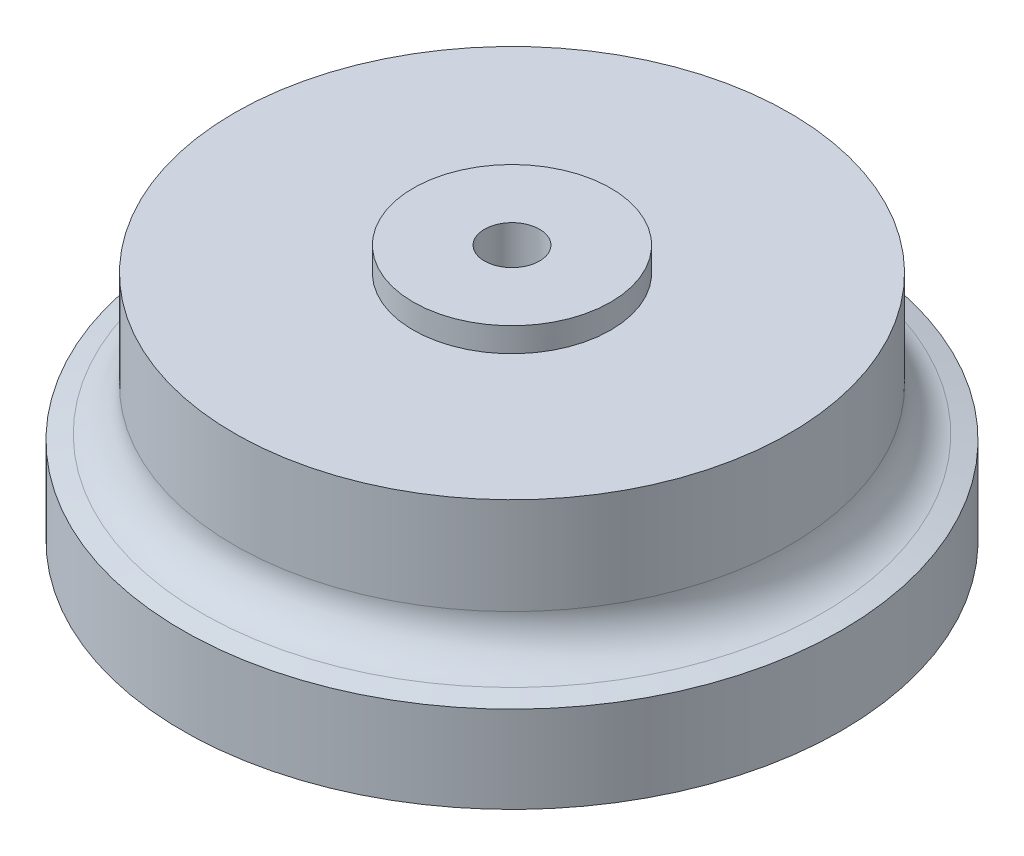
from build123d import *

# Parameters (mm, degrees)
F_1_4_0_25_DIAMETER_HOLE1_D = 6.35
SKETCH3_R                   = 11.3792
SKETCH3_R_2                 = 3.175
BOSS_EXTRUDE1_DEPTH         = 2.794


with BuildPart() as part:
    # Sketch1 → Revolve1 (revolve)
    with BuildSketch(Plane.XY, mode=Mode.PRIVATE) as revolve1_sk:
        with BuildLine():
            Line((0, 0), (37.973, 0))
            Line((37.973, 0), (37.973, 10.0076))
            Line((37.973, 10.0076), (35.750149251, 10.603211063))
            ThreePointArc((35.750149251, 10.603211063), (33.034715031, 12.417606201), (31.98495, 15.510114261))
            Line((31.98495, 15.510114261), (31.98495, 26.67))
            Line((31.98495, 26.67), (0, 26.67))
            Line((0, 26.67), (0, 0))
        make_face()
    revolve(revolve1_sk.sketch.rotate(Axis((0, 26.67, 0), (0, -1, 0)), 180), axis=Axis((0, 26.67, 0), (0, -1, 0)))

    # 1/4 (0.25) Diameter Hole1 (through all)
    with Locations(Plane(origin=(0, 26.67, 0), x_dir=(1, 0, 0), z_dir=(0, 1, 0))):
        with Locations((0, 0)):
            Hole(F_1_4_0_25_DIAMETER_HOLE1_D / 2)

    # Sketch3 → Boss-Extrude1 (add)
    with BuildSketch(Plane(origin=(0, 26.67, 0), x_dir=(1, 0, 0), z_dir=(0, 1, 0))):
        Circle(SKETCH3_R)
        with Locations(Location((0, 0, 0), (0, 0, 270))):
            Circle(SKETCH3_R_2, mode=Mode.SUBTRACT)
    extrude(amount=BOSS_EXTRUDE1_DEPTH)


solid = part.part
